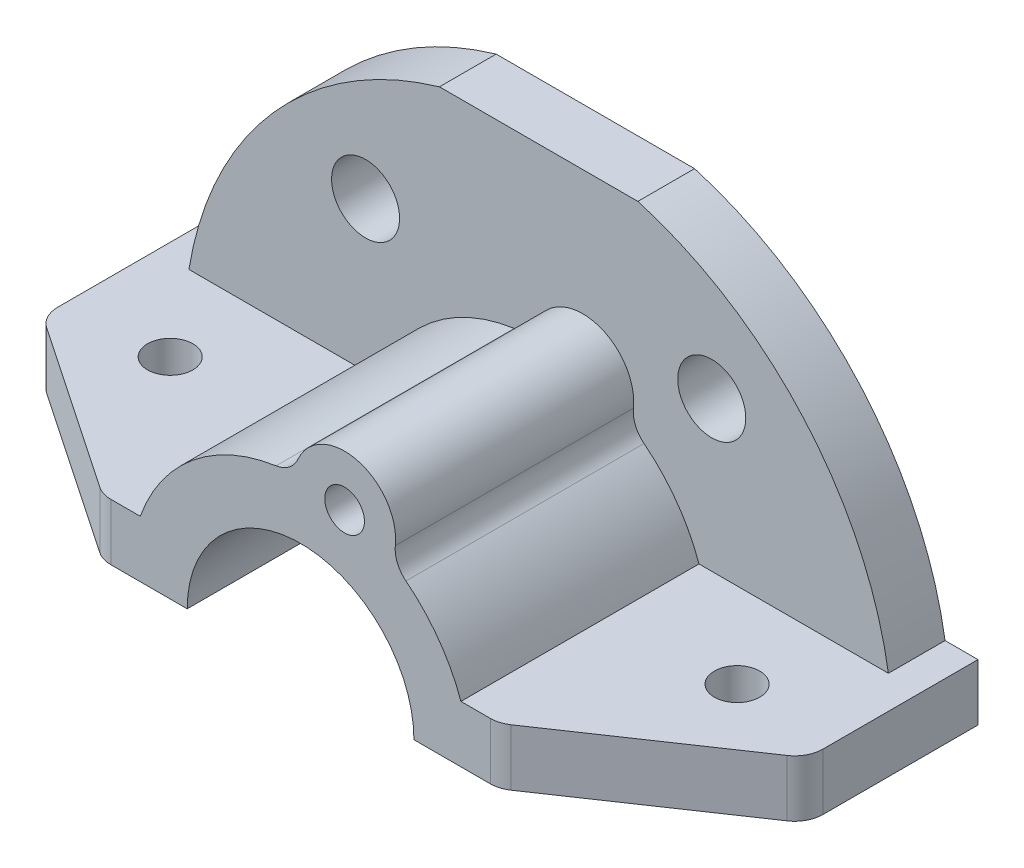
from build123d import *

# Parameters (mm, degrees)
SKETCH1_R           = 3.5
BOSS_EXTRUDE1_DEPTH = 52
SKETCH2_R           = 6
BOSS_EXTRUDE2_DEPTH = 10
SKETCH3_R           = 4
CUT_EXTRUDE1_DEPTH  = 10
FILLET1_R           = 5


with BuildPart() as part:
    # Sketch1 → Boss-Extrude1 (new body)
    with BuildSketch(Plane.XY):
        with BuildLine():
            Line((-28.284271247, 10), (-67.5, 10))
            Line((-67.5, 10), (-67.5, 0))
            Line((-67.5, 0), (-20, 0))
            ThreePointArc((-20, 0), (0, 20), (20, 0))
            Line((20, 0), (67.5, 0))
            Line((67.5, 0), (67.5, 10))
            Line((67.5, 10), (28.284271247, 10))
            ThreePointArc((28.284271247, 10), (23.442777244, 18.719941108), (16.010141687, 25.370758033))
            ThreePointArc((16.010141687, 25.370758033), (10.093942759, 37.671107225), (-1.179810402, 29.976791813))
            ThreePointArc((-1.179810402, 29.976791813), (-17.798906698, 24.149511804), (-28.284271247, 10))
        make_face()
        with Locations((7.764571353, 28.977774789)):
            Circle(SKETCH1_R, mode=Mode.SUBTRACT)
    extrude(amount=-BOSS_EXTRUDE1_DEPTH)

    # Sketch2 → Boss-Extrude2 (add)
    with BuildSketch(Plane.XY.offset(-42)):
        with BuildLine():
            Line((17.5, 60), (-17.5, 60))
            ThreePointArc((-17.5, 60), (-46.82899334, 41.391972444), (-61.694813396, 10))
            Line((-61.694813396, 10), (-28.284271247, 10))
            ThreePointArc((-28.284271247, 10), (-17.798906698, 24.149511804), (-1.179810402, 29.976791813))
            ThreePointArc((-1.179810402, 29.976791813), (10.093942759, 37.671107225), (16.010141687, 25.370758033))
            ThreePointArc((16.010141687, 25.370758033), (23.442777244, 18.719941108), (28.284271247, 10))
            Line((28.284271247, 10), (61.694813396, 10))
            ThreePointArc((61.694813396, 10), (46.82899334, 41.391972444), (17.5, 60))
        make_face()
        with Locations((30.53241146, 36.387111048)):
            Circle(SKETCH2_R, mode=Mode.SUBTRACT)
        with Locations(Location((-30.53241146, 36.387111048, 0), (0, 0, 180))):
            Circle(SKETCH2_R, mode=Mode.SUBTRACT)
    extrude(amount=-BOSS_EXTRUDE2_DEPTH)

    # Sketch3 → Cut-Extrude1 (cut)
    with BuildSketch(Plane(origin=(0, 0, 0), x_dir=(1, 0, 0), z_dir=(0, 1, 0))):
        with Locations(Location((50, 27, 0), (0, 0, 270))):
            Circle(SKETCH3_R)
        with Locations(Location((-50, 27, 0), (0, 0, 90))):
            Circle(SKETCH3_R)
        Polygon((67.5, 22), (35, 0), (67.5, 0), align=None)
        Polygon((-67.5, 0), (-67.5, 22), (-35, 0), align=None)
    extrude(amount=CUT_EXTRUDE1_DEPTH, mode=Mode.SUBTRACT)

    # Fillet1
    fillet1_edges = [part.edges().sort_by_distance(p)[0] for p in [
        (16.010141687, 25.370758033, -21),
        (-1.179810402, 29.976791813, -21),
        (67.5, 5, -22),
        (35, 5, 0),
        (-35, 5, 0),
        (-67.5, 5, -22),
    ]]
    fillet(fillet1_edges, radius=FILLET1_R)


solid = part.part
